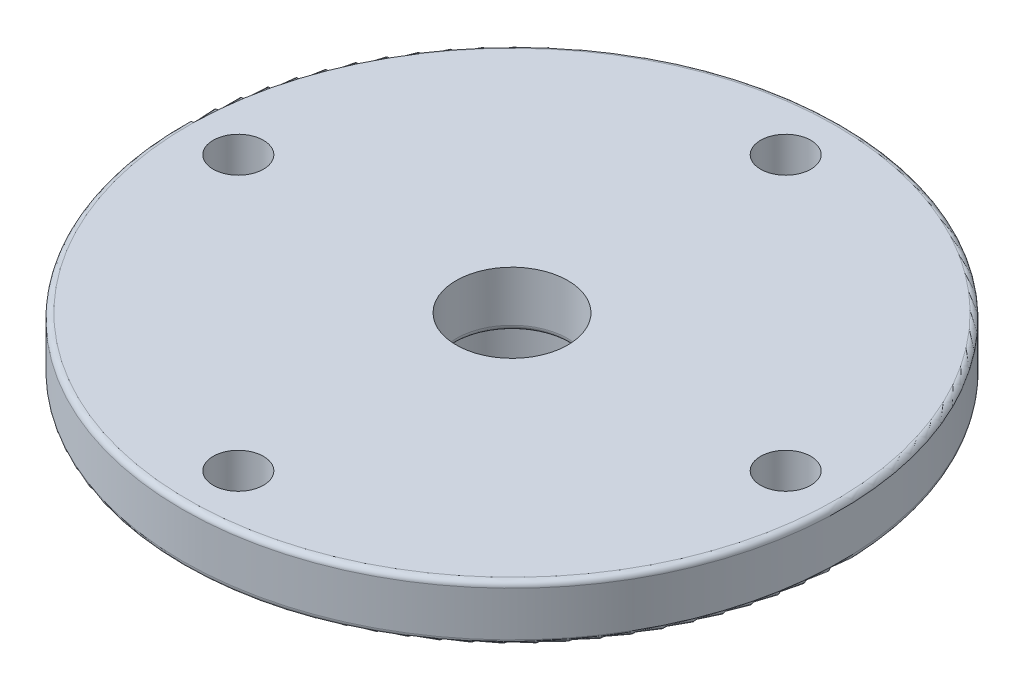
from build123d import *

# Parameters (mm, degrees)
HOLE_WIZARD_M4_1_D     = 4.5
HOLE_WIZARD_M4_1_DEPTH = 20
HOLE_WIZARD_M4_1_TIP   = 1.351936393
FILLET_1_R             = 0.5
FILLET_2_R             = 0.5
HOLE_WIZARD_M3_1_D     = 2.5
HOLE_WIZARD_M3_1_DEPTH = 8.5
HOLE_WIZARD_M3_1_TIP   = 0.751075774


with BuildPart() as part:
    # 草图1 → 旋转1 (revolve)
    with BuildSketch(Plane.XY, mode=Mode.PRIVATE) as revolve_1_sk:
        Polygon((-6.5, 115), (-6.5, 105), (-9.5, 105), (-9.5, 115), (-29.5, 115), (-29.5, 120), (-5, 120), (-5, 115), align=None)
    revolve(revolve_1_sk.sketch.rotate(Axis((0, 105, 0), (0, 1, 0)), 270), axis=Axis((0, 105, 0), (0, 1, 0)))

    # M4 间隙孔1
    with Locations(Plane(origin=(-24.5, 115, 0), x_dir=(0, 0, -1), z_dir=(0, -1, 0))):
        with Locations((0, 0), (-24.5, 24.5), (0, 49), (24.5, 24.5)):
            Hole(HOLE_WIZARD_M4_1_D / 2, depth=HOLE_WIZARD_M4_1_DEPTH)
            with Locations((0, 0, -(HOLE_WIZARD_M4_1_DEPTH + HOLE_WIZARD_M4_1_TIP / 2))):  # 118° drill point
                Cone(0, HOLE_WIZARD_M4_1_D / 2, HOLE_WIZARD_M4_1_TIP, mode=Mode.SUBTRACT)

    # 圆角1
    fillet_1_edges = [part.edges().sort_by_distance(p)[0] for p in [
        (0, 105, 9.5),
        (0, 115, 9.5),
        (0, 115, 29.5),
        (0, 120, 29.5),
        (0, 115, 5),
    ]]
    fillet(fillet_1_edges, radius=FILLET_1_R)

    # 圆角2
    fillet_2_edges = [part.edges().sort_by_distance(p)[0] for p in [
        (0, 115, 6.5),
        (0, 105, 6.5),
    ]]
    fillet(fillet_2_edges, radius=FILLET_2_R)

    # M3 螺纹孔1
    with Locations(Plane(origin=(-6.5, 110, 0), x_dir=(0, 0, 1), z_dir=(1, 0, 0))):
        with Locations((0, 0)):
            Hole(HOLE_WIZARD_M3_1_D / 2, depth=HOLE_WIZARD_M3_1_DEPTH)
            with Locations((0, 0, -(HOLE_WIZARD_M3_1_DEPTH + HOLE_WIZARD_M3_1_TIP / 2))):  # 118° drill point
                Cone(0, HOLE_WIZARD_M3_1_D / 2, HOLE_WIZARD_M3_1_TIP, mode=Mode.SUBTRACT)


solid = part.part
